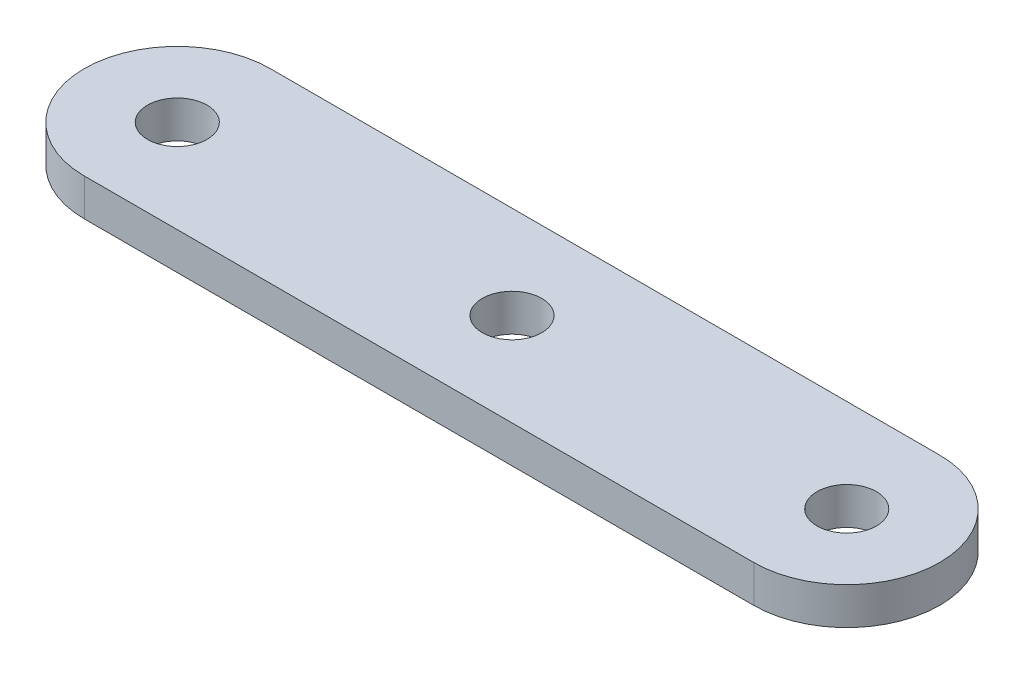
from build123d import *

# Parameters (mm, degrees)
SKETCH1_R           = 1.6
BOSS_EXTRUDE1_DEPTH = 2


with BuildPart() as part:
    # Sketch1 → Boss-Extrude1 (new body)
    with BuildSketch(Plane(origin=(0, 0, 0), x_dir=(1, 0, 0), z_dir=(0, 1, 0))):
        with BuildLine():
            Line((-18, 5), (18, 5))
            ThreePointArc((18, 5), (23, 0), (18, -5))
            Line((18, -5), (-18, -5))
            ThreePointArc((-18, -5), (-23, 0), (-18, 5))
        make_face()
        with Locations(Location((18, 0, 0), (0, 0, 270))):
            Circle(SKETCH1_R, mode=Mode.SUBTRACT)
        with Locations(Location((-18, 0, 0), (0, 0, 90))):
            Circle(SKETCH1_R, mode=Mode.SUBTRACT)
        with Locations(Location((0, 0, 0), (0, 0, 270))):
            Circle(SKETCH1_R, mode=Mode.SUBTRACT)
    extrude(amount=BOSS_EXTRUDE1_DEPTH)


solid = part.part
